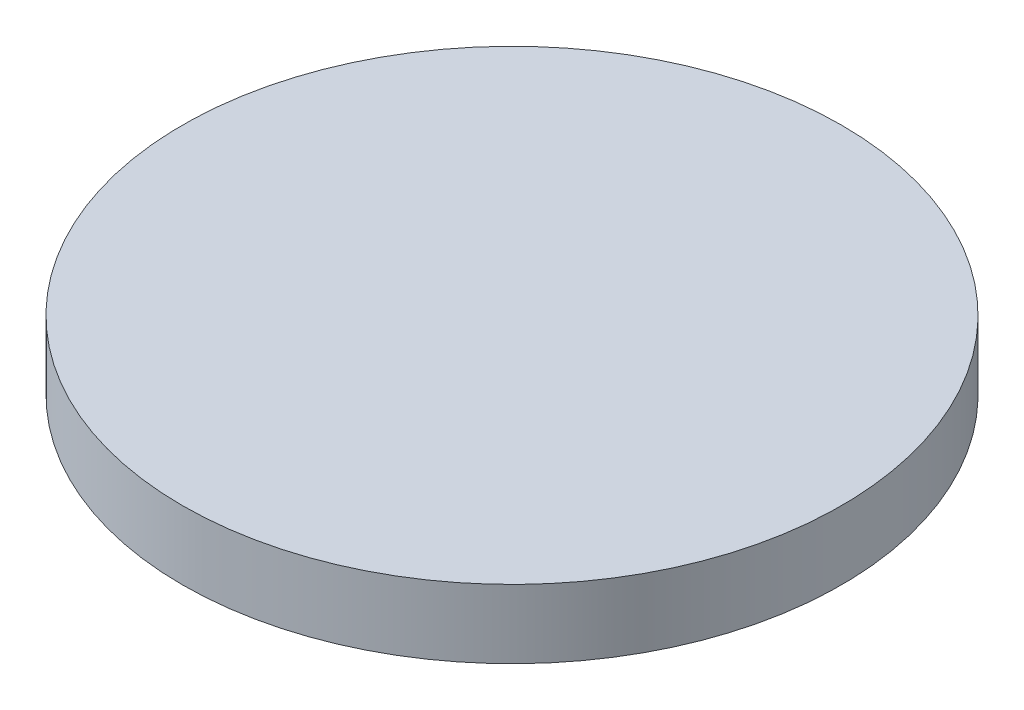
from build123d import *

# Parameters (mm, degrees)
SKETCH_2_R      = 12
EXTRUDE_1_DEPTH = 2.5


with BuildPart() as part:
    # 草图2 → 凸台-拉伸1 (new body)
    with BuildSketch(Plane(origin=(0, 0, 0), x_dir=(1, 0, 0), z_dir=(0, 1, 0))):
        with Locations(Location((0, 0, 0), (0, 0, 270))):
            Circle(SKETCH_2_R)
    extrude(amount=EXTRUDE_1_DEPTH)


solid = part.part
